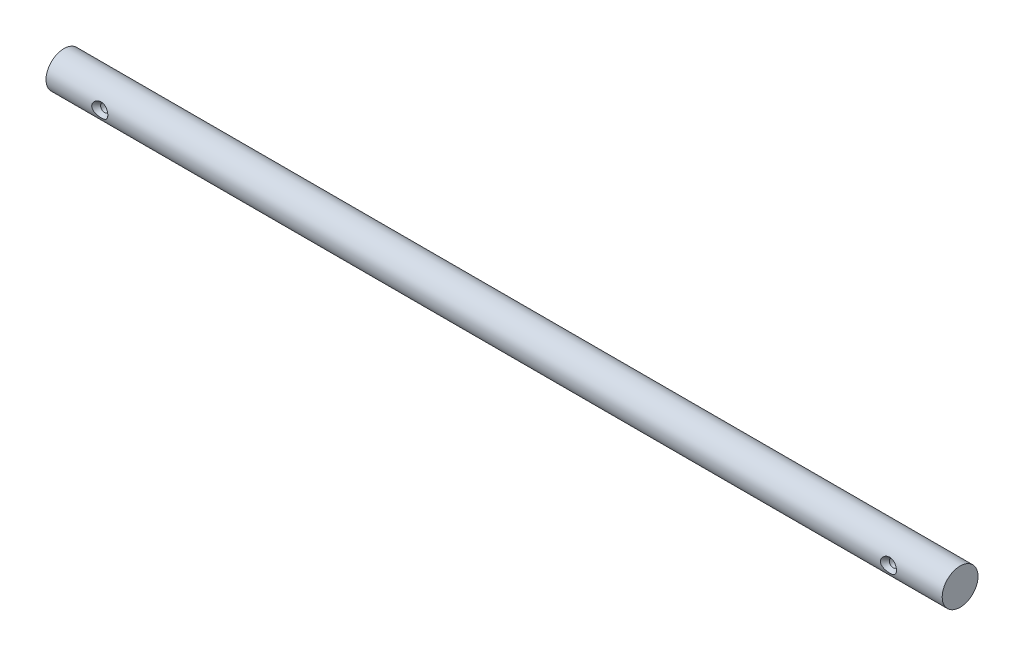
from build123d import *

# Parameters (mm, degrees)
SKETCH1_W                                         = 317.5
SKETCH1_H                                         = 6.35
CSK_FOR_4_FLAT_HEAD_MACHINE_SCREW_100_D           = 2.778125
CSK_FOR_4_FLAT_HEAD_MACHINE_SCREW_100_CSINK_D     = 5.715
CSK_FOR_4_FLAT_HEAD_MACHINE_SCREW_100_CSINK_ANGLE = 82


with BuildPart() as part:
    # Sketch1 → Revolve1 (revolve)
    with BuildSketch(Plane.XY):
        with Locations((158.75, 3.175)):
            Rectangle(SKETCH1_W, SKETCH1_H)
    revolve(axis=Axis((0, 0, 0), (1, 0, 0)))

    # CSK for #4 Flat Head Machine Screw (100)1 (through all)
    with Locations(Plane.XY.offset(6.35)):
        with Locations((19.05, 0), (298.45, 0)):
            CounterSinkHole(CSK_FOR_4_FLAT_HEAD_MACHINE_SCREW_100_D / 2, CSK_FOR_4_FLAT_HEAD_MACHINE_SCREW_100_CSINK_D / 2, counter_sink_angle=CSK_FOR_4_FLAT_HEAD_MACHINE_SCREW_100_CSINK_ANGLE)


solid = part.part
